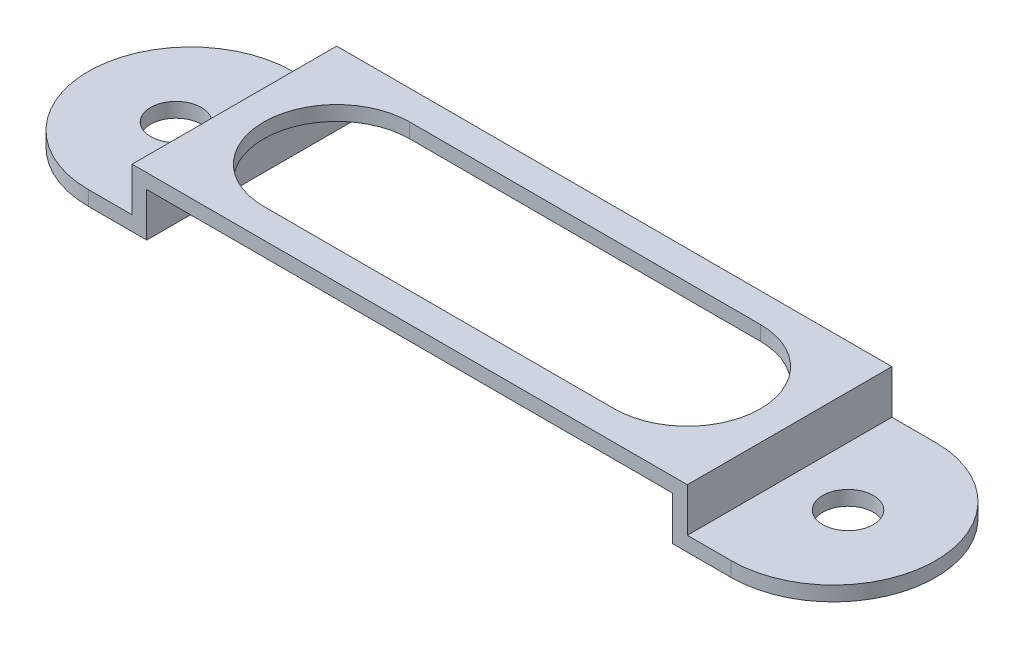
from build123d import *

# Parameters (mm, degrees)
BOSS_EXTRUDE1_DEPTH  = 6.35
SKETCH6_W            = 57.15
SKETCH6_H            = 4.7625
SKETCH6_W_2          = 15.875
CUT_EXTRUDE1_DEPTH   = 85.197384349
M5_CLEARANCE_HOLE1_D = 5.5


with BuildPart() as part:
    # Sketch2 → Boss-Extrude1 (new body)
    with BuildSketch(Plane(origin=(0, 0, 0), x_dir=(1, 0, 0), z_dir=(0, 1, 0))):
        with BuildLine():
            Line((0, 11.1125), (69.85, 11.1125))
            ThreePointArc((69.85, 11.1125), (80.9625, 0), (69.85, -11.1125))
            Line((69.85, -11.1125), (0, -11.1125))
            ThreePointArc((0, -11.1125), (-11.1125, 0), (0, 11.1125))
        make_face()
        with BuildLine():
            Line((15.875, 7.9375), (53.975, 7.9375))
            ThreePointArc((53.975, 7.9375), (61.9125, 0), (53.975, -7.9375))
            Line((53.975, -7.9375), (15.875, -7.9375))
            ThreePointArc((15.875, -7.9375), (7.9375, 0), (15.875, 7.9375))
        make_face(mode=Mode.SUBTRACT)
    extrude(amount=BOSS_EXTRUDE1_DEPTH)

    # Sketch6 → Cut-Extrude1 (cut, through all)
    with BuildSketch(Plane(origin=(0, 0, -11.1125), x_dir=(-1, 0, 0), z_dir=(0, 0, -1))):
        with Locations((-34.925, 2.38125)):
            Rectangle(SKETCH6_W, SKETCH6_H)
        with Locations((-73.025, 3.96875)):
            Rectangle(SKETCH6_W_2, SKETCH6_H)
        with Locations((3.175, 3.96875)):
            Rectangle(SKETCH6_W_2, SKETCH6_H)
    extrude(amount=-CUT_EXTRUDE1_DEPTH, mode=Mode.SUBTRACT)

    # M5 Clearance Hole1 (through all)
    with Locations(Plane(origin=(0, 1.5875, 0), x_dir=(1, 0, 0), z_dir=(0, 1, 0))):
        with Locations((-1.5875, 0), (71.4375, 0)):
            Hole(M5_CLEARANCE_HOLE1_D / 2)


solid = part.part
